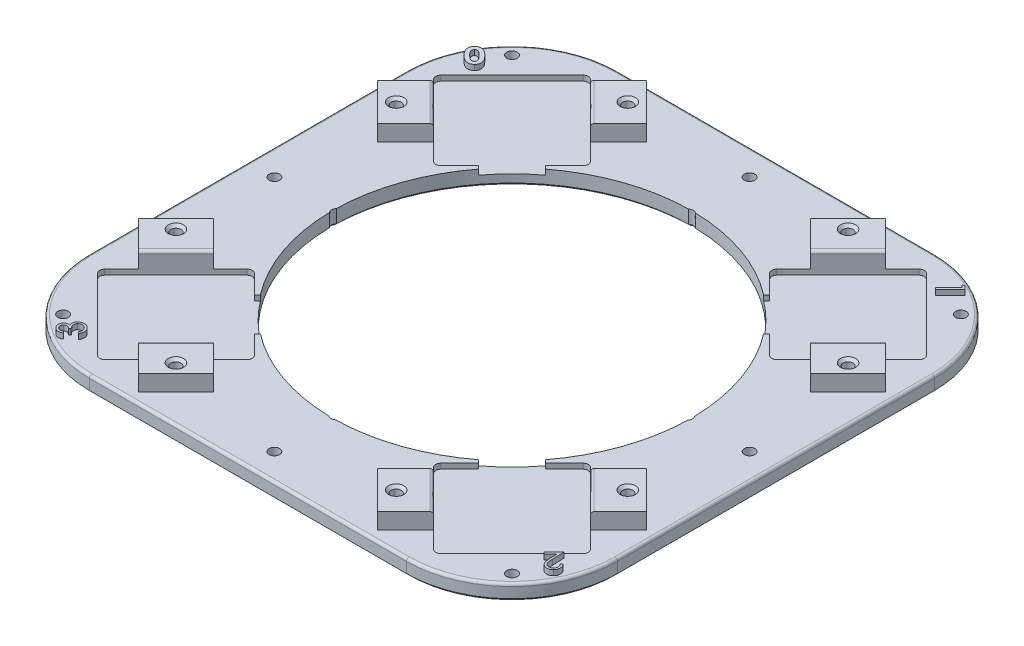
from build123d import *

# Parameters (mm, degrees)
SKETCH_1_W               = 200
SKETCH_1_H               = 200
SKETCH_1_R               = 2
EXTRUDE_1_DEPTH          = 6
CUT_EXTRUDE_1_DEPTH      = 2
FILLET_1_R               = 2
EXTRUDE_3_DEPTH          = 6
FILLET_4_R               = 40
SKETCH_4_R               = 1.9
CUT_EXTRUDE_2_DEPTH      = 8
SKETCH_7_R               = 12
SKETCH_7_W               = 40
SKETCH_7_H               = 12
SKETCH_7_W_2             = 12
SKETCH_7_H_2             = 40
CUT_EXTRUDE_3_DEPTH      = 6
CUT_EXTRUDE_4_DEPTH      = 2
FILLET_6_R               = 1
SKETCH_9_R               = 2
CUT_EXTRUDE_5_DEPTH      = 10
EXTRUDE_6_DEPTH          = 2
FILLET_9_R               = 1
CUT_EXTRUDE_6_DEPTH      = 142.548578234
CUT_EXTRUDE_6_DEPTH_BACK = 142.548578234
SKETCH_11_R              = 68
CHAMFER_1_SIZE           = 1
CHAMFER_2_SIZE           = 1


with BuildPart() as part:
    # Эскиз1 → Бобышка-Вытянуть1 (new body)
    with BuildSketch(Plane(origin=(0, 0, 0), x_dir=(1, 0, 0), z_dir=(0, 1, 0))):
        Rectangle(SKETCH_1_W, SKETCH_1_H)
        with Locations(Location((-90, 0, 0), (0, 0, 270))):
            Circle(SKETCH_1_R, mode=Mode.SUBTRACT)
        with Locations(Location((0, 90, 0), (0, 0, 270))):
            Circle(SKETCH_1_R, mode=Mode.SUBTRACT)
        with Locations(Location((90, 0, 0), (0, 0, 270))):
            Circle(SKETCH_1_R, mode=Mode.SUBTRACT)
        with Locations(Location((0, -90, 0), (0, 0, 270))):
            Circle(SKETCH_1_R, mode=Mode.SUBTRACT)
        with Locations(Location((-85, 85, 0), (0, 0, 270))):
            Circle(SKETCH_1_R, mode=Mode.SUBTRACT)
        with Locations(Location((85, 85, 0), (0, 0, 270))):
            Circle(SKETCH_1_R, mode=Mode.SUBTRACT)
        with Locations(Location((85, -85, 0), (0, 0, 270))):
            Circle(SKETCH_1_R, mode=Mode.SUBTRACT)
        with Locations(Location((-85, -85, 0), (0, 0, 270))):
            Circle(SKETCH_1_R, mode=Mode.SUBTRACT)
    extrude(amount=EXTRUDE_1_DEPTH)

    # Эскиз2 → Вырез-Вытянуть1 (cut)
    with BuildSketch(Plane(origin=(0, 6, 0), x_dir=(1, 0, 0), z_dir=(0, 1, 0))):
        Polygon((63.639610307, 33.941125497), (33.941125497, 63.639610307), (63.639610307, 93.338095117), (93.338095117, 63.639610307), align=None)
        Polygon((33.941125497, -63.639610307), (63.639610307, -33.941125497), (93.338095117, -63.639610307), (63.639610307, -93.338095117), align=None)
        Polygon((-63.639610307, -33.941125497), (-33.941125497, -63.639610307), (-63.639610307, -93.338095117), (-93.338095117, -63.639610307), align=None)
        Polygon((-33.941125497, 63.639610307), (-63.639610307, 33.941125497), (-93.338095117, 63.639610307), (-63.639610307, 93.338095117), align=None)
    extrude(amount=-CUT_EXTRUDE_1_DEPTH, mode=Mode.SUBTRACT)

    # Скругление1
    fillet_1_edges = [part.edges().sort_by_distance(p)[0] for p in [
        (93.338095117, 5, -63.639610307),
        (63.639610307, 5, -33.941125497),
        (33.941125497, 5, -63.639610307),
        (63.639610307, 5, -93.338095117),
        (-93.338095117, 5, 63.639610307),
        (-63.639610307, 5, 33.941125497),
        (-33.941125497, 5, 63.639610307),
        (-63.639610307, 5, 93.338095117),
        (-63.639610307, 5, -93.338095117),
        (-33.941125497, 5, -63.639610307),
        (-63.639610307, 5, -33.941125497),
        (-93.338095117, 5, -63.639610307),
        (63.639610307, 5, 93.338095117),
        (33.941125497, 5, 63.639610307),
        (63.639610307, 5, 33.941125497),
        (93.338095117, 5, 63.639610307),
    ]]
    fillet(fillet_1_edges, radius=FILLET_1_R)

    # Эскиз3 → Бобышка-Вытянуть3 (add)
    with BuildSketch(Plane(origin=(0, 6, 0), x_dir=(1, 0, 0), z_dir=(0, 1, 0))):
        Polygon((41.71930009, 71.4177849), (55.861435714, 85.559920524), (45.254833996, 96.166522241), (31.112698372, 82.024386618), align=None)
        Polygon((85.559920524, 55.861435714), (96.166522241, 45.254833996), (82.024386618, 31.112698372), (71.4177849, 41.71930009), align=None)
        Polygon((71.4177849, -41.71930009), (85.559920524, -55.861435714), (96.166522241, -45.254833996), (82.024386618, -31.112698372), align=None)
        Polygon((31.112698372, -82.024386618), (45.254833996, -96.166522241), (55.861435714, -85.559920524), (41.71930009, -71.4177849), align=None)
        Polygon((-41.71930009, -71.4177849), (-55.861435714, -85.559920524), (-45.254833996, -96.166522241), (-31.112698372, -82.024386618), align=None)
        Polygon((-85.559920524, -55.861435714), (-96.166522241, -45.254833996), (-82.024386618, -31.112698372), (-71.4177849, -41.71930009), align=None)
        Polygon((-71.4177849, 41.71930009), (-85.559920524, 55.861435714), (-96.166522241, 45.254833996), (-82.024386618, 31.112698372), align=None)
        Polygon((-31.112698372, 82.024386618), (-45.254833996, 96.166522241), (-55.861435714, 85.559920524), (-41.71930009, 71.4177849), align=None)
    extrude(amount=EXTRUDE_3_DEPTH)

    # Скругление4
    fillet_4_edges = [part.edges().sort_by_distance(p)[0] for p in [
        (100, 3, 100),
        (-100, 3, 100),
        (-100, 3, -100),
        (100, 3, -100),
    ]]
    fillet(fillet_4_edges, radius=FILLET_4_R)

    # Эскиз4 → Вырез-Вытянуть2 (cut)
    with BuildSketch(Plane(origin=(0, 12, 0), x_dir=(1, 0, 0), z_dir=(0, 1, 0))):
        with Locations(Location((41.71930009, 85.559920524, 0), (0, 0, 270))):
            Circle(SKETCH_4_R)
        with Locations(Location((85.559920524, 41.71930009, 0), (0, 0, 90))):
            Circle(SKETCH_4_R)
        with Locations(Location((85.559920524, -41.71930009, 0), (0, 0, 270))):
            Circle(SKETCH_4_R)
        with Locations(Location((41.71930009, -85.559920524, 0), (0, 0, 90))):
            Circle(SKETCH_4_R)
        with Locations(Location((-41.71930009, -85.559920524, 0), (0, 0, 270))):
            Circle(SKETCH_4_R)
        with Locations(Location((-85.559920524, -41.71930009, 0), (0, 0, 90))):
            Circle(SKETCH_4_R)
        with Locations(Location((-85.559920524, 41.71930009, 0), (0, 0, 270))):
            Circle(SKETCH_4_R)
        with Locations(Location((-41.71930009, 85.559920524, 0), (0, 0, 90))):
            Circle(SKETCH_4_R)
    extrude(amount=-CUT_EXTRUDE_2_DEPTH, mode=Mode.SUBTRACT)

    # Эскиз7 → Вырез-Вытянуть3 (cut)
    with BuildSketch(Plane(origin=(0, 6, 0), x_dir=(1, 0, 0), z_dir=(0, 1, 0))):
        with Locations(Location((28.284271247, 28.284271247, 0), (0, 0, 270))):
            Circle(SKETCH_7_R)
        with Locations(Location((28.284271247, -28.284271247, 0), (0, 0, 270))):
            Circle(SKETCH_7_R)
        with Locations(Location((-28.284271247, -28.284271247, 0), (0, 0, 270))):
            Circle(SKETCH_7_R)
        with Locations(Location((-28.284271247, 28.284271247, 0), (0, 0, 270))):
            Circle(SKETCH_7_R)
        with Locations((40, 0)):
            Rectangle(SKETCH_7_W, SKETCH_7_H)
        with Locations((0, 40)):
            Rectangle(SKETCH_7_W_2, SKETCH_7_H_2)
        with Locations((0, -40)):
            Rectangle(SKETCH_7_W_2, SKETCH_7_H_2)
        with Locations((-40, 0)):
            Rectangle(SKETCH_7_W, SKETCH_7_H)
    extrude(amount=-CUT_EXTRUDE_3_DEPTH, mode=Mode.SUBTRACT)

    # Эскиз8 → Вырез-Вытянуть4 (cut)
    with BuildSketch(Plane(origin=(0, 6, 0), x_dir=(1, 0, 0), z_dir=(0, 1, 0))):
        Polygon((44.547727215, 31.819805153), (31.819805153, 44.547727215), (53.033008589, 65.76093065), (65.76093065, 53.033008589), align=None)
        Polygon((65.76093065, -53.033008589), (53.033008589, -65.76093065), (31.819805153, -44.547727215), (44.547727215, -31.819805153), align=None)
        Polygon((-44.547727215, -31.819805153), (-31.819805153, -44.547727215), (-53.033008589, -65.76093065), (-65.76093065, -53.033008589), align=None)
        Polygon((-65.76093065, 53.033008589), (-53.033008589, 65.76093065), (-31.819805153, 44.547727215), (-44.547727215, 31.819805153), align=None)
    extrude(amount=-CUT_EXTRUDE_4_DEPTH, mode=Mode.SUBTRACT)

    # Скругление6
    fillet_6_edges = [part.edges().sort_by_distance(p)[0] for p in [
        (48.790367902, 12, -78.488852712),
        (78.488852712, 12, -48.790367902),
        (78.488852712, 12, 48.790367902),
        (48.790367902, 12, 78.488852712),
        (-48.790367902, 12, 78.488852712),
        (-78.488852712, 12, 48.790367902),
        (-78.488852712, 12, -48.790367902),
        (-48.790367902, 12, -78.488852712),
    ]]
    fillet(fillet_6_edges, radius=FILLET_6_R)

    # Эскиз9 → Вырез-Вытянуть5 (cut)
    with BuildSketch(Plane(origin=(0, 6, 0), x_dir=(1, 0, 0), z_dir=(0, 1, 0))):
        with Locations(Location((0.141931936, 66.467885895, 0), (0, 0, 270))):
            Circle(SKETCH_9_R)
        with Locations(Location((-0.141931936, -66.467885895, 0), (0, 0, 90))):
            Circle(SKETCH_9_R)
        with Locations(Location((66.467885895, -0.141931936, 0), (0, 0, 270))):
            Circle(SKETCH_9_R)
        with Locations(Location((-66.467885895, 0.141931936, 0), (0, 0, 90))):
            Circle(SKETCH_9_R)
    extrude(amount=-CUT_EXTRUDE_5_DEPTH, mode=Mode.SUBTRACT)

    # Эскиз10 → Бобышка-Вытянуть6 (add)
    # profile 1 of 4: a face of its own
    with BuildSketch(Plane(origin=(0, 6, 0), x_dir=(1, 0, 0), z_dir=(0, 1, 0))):
        with BuildLine():
            add(Edge.make_bspline(
                [(-93.008725725, 78.748142248), (-92.957598681, 78.797521313), (-92.85676014, 78.894912293), (-92.695816741, 79.025623668), (-92.532835835, 79.143607747), (-92.364444707, 79.244705894), (-92.19338747, 79.333809788), (-92.016821516, 79.405990635), (-91.83577231, 79.461704551), (-91.651864556, 79.505826632), (-91.463065577, 79.533008597), (-91.270612251, 79.544105355), (-91.074440499, 79.539176393), (-90.875174478, 79.51794816), (-90.671949254, 79.481192006), (-90.46586329, 79.425437226), (-90.254902601, 79.357171516), (-90.040488058, 79.269212477), (-89.819864955, 79.163420892), (-89.593527751, 79.033863441), (-89.359570967, 78.882570897), (-89.117138773, 78.709656313), (-88.869800196, 78.51114685), (-88.612296924, 78.293135309), (-88.348308293, 78.050855484), (-88.172747767, 77.8784765), (-88.082443673, 77.789808915)],
                knots=[0, 0, 0, 0, 0.898182766, 1.771497688, 2.618542862, 3.439672004, 4.25211909, 5.054711465, 5.847125212, 6.644844624, 7.443249755, 8.254994895, 9.079117631, 9.921086753, 10.786032602, 11.686927653, 12.618018076, 13.587382576, 14.61431454, 15.709081657, 16.881705886, 18.135395254, 19.471648796, 20.88972771, 22.400151059, 24, 24, 24, 24], degree=3))
            add(Edge.make_bspline(
                [(-88.082443673, 77.789808915), (-87.99267599, 77.698463012), (-87.818629055, 77.521356129), (-87.574075163, 77.254376099), (-87.352755723, 76.995556331), (-87.155322982, 76.743444497), (-86.979453593, 76.499753648), (-86.827635494, 76.263265193), (-86.697172812, 76.035199404), (-86.593983854, 75.812528771), (-86.505762897, 75.597863606), (-86.435650692, 75.388405368), (-86.380204903, 75.184114783), (-86.341999183, 74.984749296), (-86.317124562, 74.790489333), (-86.308824987, 74.600690128), (-86.317259045, 74.415819605), (-86.339029871, 74.235495262), (-86.378224262, 74.059121756), (-86.433011633, 73.88543721), (-86.503667028, 73.713843244), (-86.590455303, 73.544917992), (-86.694786221, 73.379663841), (-86.810937292, 73.213769659), (-86.94605157, 73.051911723), (-87.045954632, 72.949414733), (-87.09686675, 72.89718071)],
                knots=[0, 0, 0, 0, 1.626693129, 3.153929617, 4.597923221, 5.951226613, 7.220381534, 8.41370076, 9.519612414, 10.554665343, 11.5286677, 12.466351198, 13.358440621, 14.215441504, 15.042756246, 15.844148676, 16.625203713, 17.391079629, 18.148401381, 18.916678168, 19.701702082, 20.502864672, 21.325687275, 22.182312009, 23.073678591, 24, 24, 24, 24], degree=3))
            add(Edge.make_bspline(
                [(-87.09686675, 72.89718071), (-87.149001816, 72.84614528), (-87.251598834, 72.745712247), (-87.415449357, 72.611920711), (-87.581095452, 72.493010238), (-87.748111845, 72.387124201), (-87.920307836, 72.299502255), (-88.094627597, 72.225293141), (-88.272021467, 72.16710318), (-88.452198674, 72.125173685), (-88.635693302, 72.099819479), (-88.822639538, 72.088904452), (-89.013082719, 72.090828854), (-89.207091086, 72.1143069), (-89.40536909, 72.145719544), (-89.606567507, 72.199199877), (-89.811492576, 72.264759097), (-90.022238393, 72.344954071), (-90.237893224, 72.447094582), (-90.460693886, 72.571345842), (-90.692551034, 72.717439447), (-90.930254984, 72.890031869), (-91.177219561, 73.084109407), (-91.432290045, 73.301626079), (-91.696875667, 73.541020342), (-91.871055441, 73.713771109), (-91.960648802, 73.802629428)],
                knots=[0, 0, 0, 0, 0.933090558, 1.836236452, 2.703091185, 3.541342316, 4.363641911, 5.172278286, 5.963363672, 6.749235136, 7.536057157, 8.330354457, 9.143829215, 9.968822976, 10.828425831, 11.710347207, 12.629007139, 13.581006501, 14.593064946, 15.679156618, 16.843448976, 18.097249152, 19.435871615, 20.861513249, 22.385647378, 24, 24, 24, 24], degree=3))
            add(Edge.make_bspline(
                [(-91.960648802, 73.802629428), (-92.083808079, 73.927961036), (-92.321358131, 74.169701086), (-92.642974702, 74.539928393), (-92.927306321, 74.894846854), (-93.16830981, 75.240335887), (-93.371354338, 75.572879883), (-93.528165963, 75.896472645), (-93.650478298, 76.206379417), (-93.697573804, 76.414092671), (-93.720264186, 76.514167889)],
                knots=[0, 0, 0, 0, 1.286987725, 2.482346486, 3.591022616, 4.616940247, 5.566609133, 6.441717498, 7.249227199, 8, 8, 8, 8], degree=3))
            add(Edge.make_bspline(
                [(-93.720264186, 76.514167889), (-93.73621609, 76.619695189), (-93.767435565, 76.826222703), (-93.769463604, 77.134773214), (-93.73708647, 77.432890992), (-93.662918531, 77.719164849), (-93.557667587, 77.996586653), (-93.410830123, 78.260518954), (-93.228823871, 78.514820834), (-93.083287813, 78.669100547), (-93.008725725, 78.748142248)],
                knots=[0, 0, 0, 0, 1.045976366, 2.04708071, 3.017702948, 3.979968869, 4.940634868, 5.921098241, 6.93492198, 8, 8, 8, 8], degree=3))
        make_face()
        with BuildLine():
            add(Edge.make_bspline(
                [(-91.968661622, 77.762565325), (-92.010462791, 77.716369621), (-92.09267178, 77.625518043), (-92.185599358, 77.466056849), (-92.247808891, 77.292789759), (-92.277000053, 77.138763868), (-92.281564988, 77.009210942), (-92.272569584, 76.906266824), (-92.255217222, 76.798367336), (-92.225720447, 76.685914195), (-92.185705795, 76.569081549), (-92.133366823, 76.447952044), (-92.070623007, 76.322116087), (-91.998518706, 76.18904091), (-91.910791112, 76.051145738), (-91.80930652, 75.904601817), (-91.691866402, 75.749325648), (-91.559047432, 75.584504399), (-91.409818285, 75.411433598), (-91.243944165, 75.230965793), (-91.065124091, 75.039589219), (-90.938036359, 74.911792703), (-90.872507776, 74.845898658)],
                knots=[0, 0, 0, 0, 1.075604722, 2.115356592, 3.167844591, 4.248203041, 4.812243559, 5.405508209, 6.032984943, 6.700942317, 7.414044194, 8.167617197, 8.981822607, 9.846245724, 10.784711884, 11.80756956, 12.929501316, 14.151980212, 15.469127066, 16.882155306, 18.392386567, 20, 20, 20, 20], degree=3))
            add(Edge.make_bspline(
                [(-90.872507776, 74.845898658), (-90.7864976, 74.761480543), (-90.621676348, 74.599710156), (-90.376186673, 74.375708535), (-90.142591105, 74.181411662), (-89.920993001, 74.01580443), (-89.712979922, 73.876185004), (-89.516195184, 73.766835437), (-89.332031918, 73.684611929), (-89.159202852, 73.630270157), (-88.995766399, 73.602382197), (-88.842298, 73.587529693), (-88.696426487, 73.594737092), (-88.558484062, 73.616713591), (-88.427977695, 73.656297414), (-88.306707853, 73.716054158), (-88.190628178, 73.788553381), (-88.124171611, 73.852114178), (-88.090456494, 73.884360197)],
                knots=[0, 0, 0, 0, 1.768629636, 3.389223978, 4.875842697, 6.225868878, 7.447880289, 8.54973518, 9.52566295, 10.403516369, 11.200100902, 11.95533547, 12.661618695, 13.336984531, 14.001570975, 14.653788248, 15.317032326, 16, 16, 16, 16], degree=3))
            add(Edge.make_bspline(
                [(-88.090456494, 73.884360197), (-88.060170206, 73.917273087), (-88.000655379, 73.981949384), (-87.928154313, 74.090301918), (-87.872339217, 74.205569408), (-87.835909962, 74.32905055), (-87.814669853, 74.458862384), (-87.812602281, 74.595619521), (-87.824773104, 74.739340345), (-87.846722465, 74.835951399), (-87.858084699, 74.885962761)],
                knots=[0, 0, 0, 0, 0.992959701, 1.951240279, 2.885912978, 3.828695135, 4.802734124, 5.800367936, 6.861345669, 8, 8, 8, 8], degree=3))
            add(Edge.make_bspline(
                [(-87.858084699, 74.885962761), (-87.877060945, 74.949998607), (-87.916921532, 75.084509222), (-88.007273396, 75.286598194), (-88.126064612, 75.49901867), (-88.272102307, 75.722527903), (-88.44647396, 75.957027887), (-88.648604001, 76.202021519), (-88.880645166, 76.45665197), (-89.04719527, 76.627386506), (-89.133725725, 76.716090966)],
                knots=[0, 0, 0, 0, 0.710523542, 1.492491535, 2.35044932, 3.300180637, 4.333113065, 5.460466168, 6.680595133, 8, 8, 8, 8], degree=3))
            add(Edge.make_bspline(
                [(-89.133725725, 76.716090966), (-89.222964963, 76.803682764), (-89.394241612, 76.971797487), (-89.648507303, 77.205255058), (-89.891423716, 77.406883944), (-90.117816027, 77.583359819), (-90.333231584, 77.728162558), (-90.534384646, 77.845045557), (-90.723026558, 77.930887678), (-90.898556487, 77.990917344), (-91.063656834, 78.023876163), (-91.218731192, 78.040982929), (-91.365199368, 78.039958248), (-91.503588791, 78.020388828), (-91.63445609, 77.984561165), (-91.755276867, 77.926461343), (-91.869565032, 77.855138121), (-91.935391485, 77.793645199), (-91.968661622, 77.762565325)],
                knots=[0, 0, 0, 0, 1.794997963, 3.44513516, 4.953227072, 6.325945798, 7.563759521, 8.676594079, 9.661550624, 10.534529874, 11.333105772, 12.073249666, 12.771110835, 13.429383314, 14.075074024, 14.709742177, 15.347875331, 16, 16, 16, 16], degree=3))
        make_face(mode=Mode.SUBTRACT)
    # profile 2 of 4: a face of its own
    with BuildSketch(Plane(origin=(0, 6, 0), x_dir=(1, 0, 0), z_dir=(0, 1, 0))):
        Polygon((78.440095754, 93.074368887), (79.541057292, 91.973407348), (73.941698318, 86.374048374), (73.385608575, 86.930138118), (78.436890626, 91.981420169), (77.557082933, 92.861227861), align=None)
    # profile 3 of 4: a face of its own
    with BuildSketch(Plane(origin=(0, 6, 0), x_dir=(1, 0, 0), z_dir=(0, 1, 0))):
        with BuildLine():
            Line((92.978731613, -74.683298044), (93.515590587, -74.14643907))
            add(Edge.make_bspline(
                [(93.515590587, -74.14643907), (93.57979168, -74.217561095), (93.705938599, -74.357306758), (93.872192198, -74.580565611), (94.0096643, -74.812483922), (94.124946647, -75.049578001), (94.215404454, -75.292959176), (94.277694742, -75.544127868), (94.316788413, -75.801118589), (94.328555137, -76.062538369), (94.318422495, -76.32287574), (94.281216893, -76.576781617), (94.220051936, -76.822145442), (94.134830229, -77.05845039), (94.025582223, -77.28616355), (93.889081572, -77.503018406), (93.730477042, -77.712924928), (93.608225903, -77.841999489), (93.546039305, -77.907657019)],
                knots=[0, 0, 0, 0, 1.097080493, 2.155622548, 3.181877021, 4.180734131, 5.171877943, 6.149826956, 7.139761318, 8.144411119, 9.14266836, 10.119602376, 11.078258423, 12.0343727, 12.992188754, 13.965052194, 14.964864601, 16, 16, 16, 16], degree=3))
            add(Edge.make_bspline(
                [(93.546039305, -77.907657019), (93.482090698, -77.969428879), (93.356687631, -78.090563349), (93.151429875, -78.244882669), (92.942680032, -78.37895674), (92.725313898, -78.484156569), (92.502307063, -78.567304392), (92.272879379, -78.625036467), (92.036408861, -78.657581549), (91.796858495, -78.662803423), (91.558717577, -78.647071576), (91.328114136, -78.610221179), (91.106309941, -78.554059657), (90.894170445, -78.476955727), (90.69100415, -78.378911034), (90.498450265, -78.258608397), (90.312382857, -78.122050971), (90.200365868, -78.014736799), (90.143795716, -77.960541634)],
                knots=[0, 0, 0, 0, 1.122093018, 2.200421744, 3.237554738, 4.251534574, 5.244276876, 6.239309773, 7.233678941, 8.25294369, 9.26061734, 10.244606756, 11.198736813, 12.14649875, 13.09110873, 14.042419092, 15.011394142, 16, 16, 16, 16], degree=3))
            add(Edge.make_bspline(
                [(90.143795716, -77.960541634), (90.06838982, -77.879576092), (89.91877248, -77.718927525), (89.733967572, -77.445845524), (89.584072127, -77.153182093), (89.489411425, -76.889885212), (89.430647816, -76.660895349), (89.391527922, -76.464896649), (89.354319473, -76.246967695), (89.323162154, -76.005743563), (89.29417061, -75.742397125), (89.270319478, -75.45596892), (89.251579707, -75.147093558), (89.241802351, -74.933312205), (89.236744434, -74.822721121)],
                knots=[0, 0, 0, 0, 1.186803905, 2.354808508, 3.527369274, 4.71059022, 5.350674727, 6.065137202, 6.856453041, 7.724624025, 8.676850923, 9.701662735, 10.811048734, 12, 12, 12, 12], degree=3))
            Line((89.236744434, -74.822721121), (89.12616751, -71.926887788))
            Line((89.12616751, -71.926887788), (86.541231613, -74.511823685))
            Line((86.541231613, -74.511823685), (86.00116751, -73.971759583))
            Line((86.00116751, -73.971759583), (89.804052126, -70.168874967))
            Line((89.804052126, -70.168874967), (89.975526485, -74.61919548))
            add(Edge.make_bspline(
                [(89.975526485, -74.61919548), (89.97940604, -74.72712057), (89.986860215, -74.934487794), (90.003890674, -75.233029494), (90.019624168, -75.50625937), (90.043566004, -75.75394261), (90.06564968, -75.976592217), (90.095425878, -76.173535946), (90.124676221, -76.345461481), (90.168824981, -76.538523396), (90.23936523, -76.755529595), (90.356972999, -76.992365375), (90.498540406, -77.21240251), (90.616674642, -77.339291696), (90.675846998, -77.402849326)],
                knots=[0, 0, 0, 0, 1.320717269, 2.537625612, 3.657091802, 4.667335419, 5.580706193, 6.392834347, 7.10280944, 7.712944814, 8.814093938, 9.883466006, 10.93984752, 12, 12, 12, 12], degree=3))
            add(Edge.make_bspline(
                [(90.675846998, -77.402849326), (90.715762518, -77.440491138), (90.794563147, -77.514803044), (90.923578393, -77.611670036), (91.059857654, -77.691744666), (91.203081359, -77.756245876), (91.352325662, -77.808417727), (91.509417042, -77.84322442), (91.673171622, -77.86207557), (91.841072337, -77.867216475), (92.009961942, -77.855516387), (92.175462222, -77.830692716), (92.335424905, -77.788442162), (92.488974446, -77.730963732), (92.63686883, -77.65745526), (92.779385889, -77.569475576), (92.916642426, -77.465111951), (93.000335801, -77.384492124), (93.042834177, -77.343554455)],
                knots=[0, 0, 0, 0, 0.999414226, 1.973028734, 2.933162718, 3.874301026, 4.831864631, 5.809753659, 6.800020608, 7.832465231, 8.866744497, 9.881594604, 10.878159325, 11.876387246, 12.86478581, 13.883411814, 14.925224832, 16, 16, 16, 16], degree=3))
            add(Edge.make_bspline(
                [(93.042834177, -77.343554455), (93.085971983, -77.29897834), (93.170746275, -77.211377487), (93.280021317, -77.067662313), (93.371539202, -76.917986932), (93.447322526, -76.763501475), (93.507260364, -76.604334053), (93.549404033, -76.439373624), (93.572814515, -76.2684341), (93.581008072, -76.093006632), (93.571727119, -75.914621837), (93.542273015, -75.73648388), (93.495192881, -75.558323393), (93.430044659, -75.380806329), (93.34279892, -75.20509369), (93.240953397, -75.028485632), (93.118160612, -74.853500614), (93.025950971, -74.740939253), (92.978731613, -74.683298044)],
                knots=[0, 0, 0, 0, 1.00435318, 1.973751999, 2.917821866, 3.842935876, 4.757667598, 5.668706735, 6.595277109, 7.548310303, 8.510417973, 9.48367281, 10.468252952, 11.4923997, 12.541405892, 13.642871744, 14.792945286, 16, 16, 16, 16], degree=3))
        make_face()
    # profile 4 of 4: a face of its own
    with BuildSketch(Plane(origin=(0, 6, 0), x_dir=(1, 0, 0), z_dir=(0, 1, 0))):
        with BuildLine():
            Line((-77.388715553, -92.454657468), (-76.802177092, -93.02196516))
            add(Edge.make_bspline(
                [(-76.802177092, -93.02196516), (-76.872074017, -93.066285105), (-77.009193948, -93.153229528), (-77.221245979, -93.263222601), (-77.431874401, -93.355769168), (-77.64204283, -93.427893024), (-77.851510765, -93.48173737), (-78.060252855, -93.514710119), (-78.26822027, -93.532269537), (-78.474255518, -93.526358935), (-78.676988968, -93.504358079), (-78.873717005, -93.464118869), (-79.064802464, -93.407793132), (-79.248731568, -93.334076039), (-79.426690369, -93.243281798), (-79.598271698, -93.136210179), (-79.762535153, -93.010024629), (-79.865353835, -92.915908177), (-79.917561707, -92.868119006)],
                knots=[0, 0, 0, 0, 1.169279398, 2.293827799, 3.37245145, 4.41823223, 5.430864929, 6.42509182, 7.401967133, 8.376183799, 9.33334128, 10.280982312, 11.210249107, 12.145386172, 13.077317515, 14.030476502, 14.999942152, 16, 16, 16, 16], degree=3))
            add(Edge.make_bspline(
                [(-79.917561707, -92.868119006), (-79.988920031, -92.793915351), (-80.13012374, -92.647081306), (-80.306994952, -92.399433841), (-80.450747659, -92.133673041), (-80.562173881, -91.854130293), (-80.638288532, -91.566288195), (-80.673674749, -91.278376936), (-80.670891848, -90.993695007), (-80.628901464, -90.716257597), (-80.552855322, -90.450259759), (-80.442808141, -90.204893605), (-80.306804124, -89.977972028), (-80.190611, -89.848268388), (-80.132305297, -89.783183109)],
                knots=[0, 0, 0, 0, 1.079631469, 2.136372602, 3.182766178, 4.244954198, 5.288217467, 6.299582755, 7.281027378, 8.267633372, 9.236679149, 10.175611233, 11.084521819, 12, 12, 12, 12], degree=3))
            add(Edge.make_bspline(
                [(-80.132305297, -89.783183109), (-80.071332651, -89.724753249), (-79.951762443, -89.610169563), (-79.748381213, -89.471190926), (-79.532010491, -89.364348043), (-79.301508127, -89.289802953), (-79.057050132, -89.248329314), (-78.799158916, -89.239790928), (-78.527911531, -89.261925886), (-78.346160961, -89.301335363), (-78.252497604, -89.321644647)],
                knots=[0, 0, 0, 0, 0.994959293, 1.951161675, 2.892524362, 3.833211752, 4.798837926, 5.80788833, 6.870316961, 8, 8, 8, 8], degree=3))
            add(Edge.make_bspline(
                [(-78.252497604, -89.321644647), (-78.2908941, -89.227417901), (-78.366455678, -89.04198635), (-78.433533784, -88.752543136), (-78.468825619, -88.462397129), (-78.460297874, -88.26936548), (-78.456023245, -88.172606186)],
                knots=[0, 0, 0, 0, 1.034463078, 2.035749934, 3.015397462, 4, 4, 4, 4], degree=3))
            add(Edge.make_bspline(
                [(-78.456023245, -88.172606186), (-78.449288881, -88.105111251), (-78.436049064, -87.972415657), (-78.394386167, -87.778644977), (-78.340246105, -87.592612574), (-78.271950602, -87.41388508), (-78.185386109, -87.244752842), (-78.086329088, -87.082127181), (-77.970712952, -86.92772678), (-77.883148966, -86.832672184), (-77.839036066, -86.784785673)],
                knots=[0, 0, 0, 0, 1.04938919, 2.063107758, 3.062796941, 4.047250166, 5.019961658, 6.00006311, 6.992473739, 8, 8, 8, 8], degree=3))
            add(Edge.make_bspline(
                [(-77.839036066, -86.784785673), (-77.757764137, -86.707011683), (-77.595555492, -86.551784486), (-77.314339011, -86.362283402), (-77.00690324, -86.211377214), (-76.678775657, -86.096957633), (-76.337780488, -86.021689696), (-75.992384551, -85.998456457), (-75.648247161, -86.020429174), (-75.30852581, -86.092358394), (-74.975836653, -86.206866008), (-74.658919531, -86.369981879), (-74.355276993, -86.571977286), (-74.173558247, -86.737405252), (-74.081023245, -86.821644647)],
                knots=[0, 0, 0, 0, 0.966121529, 1.928258222, 2.902202989, 3.904812497, 4.910491246, 5.896124049, 6.872277065, 7.867065951, 8.874013802, 9.889062967, 10.92506653, 12, 12, 12, 12], degree=3))
            add(Edge.make_bspline(
                [(-74.081023245, -86.821644647), (-74.021853204, -86.881667927), (-73.905378738, -86.999821968), (-73.750010399, -87.188779842), (-73.616060265, -87.384318945), (-73.501384782, -87.584883398), (-73.407951202, -87.792558543), (-73.335758423, -88.006211938), (-73.283928402, -88.225649401), (-73.254012973, -88.449994375), (-73.243405037, -88.678597891), (-73.258616666, -88.909429614), (-73.295934925, -89.142204022), (-73.356030565, -89.376896446), (-73.437638527, -89.614740521), (-73.544783279, -89.853551775), (-73.672760277, -90.094886692), (-73.773237898, -90.251289766), (-73.824612989, -90.331260032)],
                knots=[0, 0, 0, 0, 1.045386523, 2.057812277, 3.030335339, 3.9831449, 4.920592867, 5.851197628, 6.777212156, 7.713628621, 8.655634425, 9.611918591, 10.578438017, 11.576706329, 12.614247281, 13.694355822, 14.821103873, 16, 16, 16, 16], degree=3))
            Line((-73.824612989, -90.331260032), (-74.387112989, -89.786388237))
            add(Edge.make_bspline(
                [(-74.387112989, -89.786388237), (-74.356108499, -89.729521047), (-74.295703021, -89.618727748), (-74.216755615, -89.452142222), (-74.152845056, -89.290175233), (-74.101233485, -89.134547193), (-74.061745375, -88.985413058), (-74.03787435, -88.841628771), (-74.0254386, -88.703252914), (-74.028325632, -88.612793387), (-74.029741194, -88.568439519)],
                knots=[0, 0, 0, 0, 1.208474665, 2.354448952, 3.437297787, 4.455450756, 5.412846772, 6.31251137, 7.172595194, 8, 8, 8, 8], degree=3))
            add(Edge.make_bspline(
                [(-74.029741194, -88.568439519), (-74.034859604, -88.513754216), (-74.045091811, -88.404432883), (-74.083607887, -88.244282225), (-74.135192606, -88.087829609), (-74.200435306, -87.934539232), (-74.284661095, -87.786835222), (-74.385183264, -87.644176856), (-74.498874455, -87.503469008), (-74.585051384, -87.416022074), (-74.629100169, -87.371324134)],
                knots=[0, 0, 0, 0, 0.961215761, 1.921565418, 2.877526972, 3.845915068, 4.834977089, 5.850130758, 6.901108131, 8, 8, 8, 8], degree=3))
            add(Edge.make_bspline(
                [(-74.629100169, -87.371324134), (-74.681090431, -87.322723333), (-74.782445027, -87.227976466), (-74.946347893, -87.106489871), (-75.110690459, -87.000747278), (-75.281027643, -86.917143209), (-75.454113249, -86.850977835), (-75.631241254, -86.803553156), (-75.812608999, -86.778698861), (-75.995053098, -86.770559067), (-76.175866677, -86.78030301), (-76.350156794, -86.805831688), (-76.517207594, -86.845992364), (-76.675973132, -86.901663669), (-76.826644699, -86.974919386), (-76.969041379, -87.0634642), (-77.105388267, -87.165921189), (-77.187099009, -87.245903166), (-77.228459143, -87.286388237)],
                knots=[0, 0, 0, 0, 1.175407728, 2.291447812, 3.366826222, 4.401376563, 5.421356114, 6.425777831, 7.424712672, 8.441055237, 9.440185163, 10.412905177, 11.348740396, 12.27587154, 13.188083527, 14.111845111, 15.044258618, 16, 16, 16, 16], degree=3))
            add(Edge.make_bspline(
                [(-77.228459143, -87.286388237), (-77.279535789, -87.343676672), (-77.381130905, -87.457627482), (-77.499712365, -87.655724529), (-77.592090729, -87.869391226), (-77.651660421, -88.098638567), (-77.68282183, -88.334507466), (-77.679719441, -88.572073434), (-77.641973735, -88.806620658), (-77.583578611, -88.999765985), (-77.514478245, -89.154475969), (-77.450854739, -89.280094261), (-77.369835179, -89.411062603), (-77.274409568, -89.548591317), (-77.16717371, -89.695487967), (-77.043439646, -89.847826927), (-76.907482639, -90.009367385), (-76.808529826, -90.115870536), (-76.757305297, -90.171003621)],
                knots=[0, 0, 0, 0, 1.121186236, 2.230119901, 3.361455773, 4.518304567, 5.684940395, 6.834367639, 7.982224936, 9.152000404, 9.775180233, 10.460538472, 11.21144107, 12.026855747, 12.910381899, 13.872566936, 14.898699748, 16, 16, 16, 16], degree=3))
            Line((-76.757305297, -90.171003621), (-77.268523245, -90.698247211))
            add(Edge.make_bspline(
                [(-77.268523245, -90.698247211), (-77.334741975, -90.637662351), (-77.464455594, -90.518984727), (-77.674721718, -90.365511058), (-77.893339725, -90.238268001), (-78.117019946, -90.138197165), (-78.337856669, -90.066171049), (-78.549142261, -90.022294312), (-78.748678618, -90.01180744), (-78.935354408, -90.032599171), (-79.107876819, -90.081434292), (-79.26675635, -90.152405628), (-79.412233777, -90.246112213), (-79.495636262, -90.325050512), (-79.537754015, -90.364913878)],
                knots=[0, 0, 0, 0, 1.265456482, 2.478859708, 3.664135126, 4.827966215, 5.929008543, 6.935492065, 7.863532652, 8.735702181, 9.573157525, 10.382716827, 11.183281726, 12, 12, 12, 12], degree=3))
            add(Edge.make_bspline(
                [(-79.537754015, -90.364913878), (-79.566835094, -90.396326023), (-79.624336337, -90.458436421), (-79.696526522, -90.562084864), (-79.756029374, -90.671258332), (-79.803081897, -90.78690076), (-79.837938732, -90.907750185), (-79.860995191, -91.034995575), (-79.869606859, -91.167658934), (-79.868291906, -91.304874511), (-79.854677693, -91.443051203), (-79.824958806, -91.578642797), (-79.783618958, -91.710304709), (-79.728268952, -91.83776375), (-79.660897843, -91.962176959), (-79.578201221, -92.082039768), (-79.484225877, -92.199700167), (-79.412386344, -92.272065664), (-79.37589504, -92.308824134)],
                knots=[0, 0, 0, 0, 0.945622928, 1.869755011, 2.784173497, 3.690084153, 4.624650255, 5.560708084, 6.543661072, 7.559560387, 8.592687063, 9.607418322, 10.623523625, 11.63942294, 12.675449106, 13.746764168, 14.855455909, 16, 16, 16, 16], degree=3))
            add(Edge.make_bspline(
                [(-79.37589504, -92.308824134), (-79.31341616, -92.364332751), (-79.191190113, -92.472923025), (-78.983632536, -92.597570118), (-78.763503707, -92.682251946), (-78.570315062, -92.721099458), (-78.409608163, -92.72848978), (-78.281445256, -92.725873293), (-78.147312061, -92.709585749), (-78.00752194, -92.679373618), (-77.861262426, -92.641186153), (-77.708597774, -92.591302884), (-77.550032642, -92.528408132), (-77.443524486, -92.47971492), (-77.388715553, -92.454657468)],
                knots=[0, 0, 0, 0, 1.401169659, 2.741077084, 4.038764372, 5.345842331, 6.028511183, 6.737373733, 7.496180119, 8.293104039, 9.137291959, 10.033670791, 10.988130031, 12, 12, 12, 12], degree=3))
        make_face()
    extrude(amount=EXTRUDE_6_DEPTH)

    # Скругление9
    fillet_9_edges = [part.edges().sort_by_distance(p)[0] for p in [
        (0, 6, -100),
        (100, 6, 0),
        (-100, 6, 0),
        (0, 6, 100),
        (-88.284271247, 6, -88.284271247),
        (-88.284271247, 6, 88.284271247),
        (88.284271247, 6, 88.284271247),
        (88.284271247, 6, -88.284271247),
    ]]
    fillet(fillet_9_edges, radius=FILLET_9_R)

    # Эскиз11 → Вырез-Вытянуть6 (cut, two sides: drawn at the far end of the back side and taken through both)
    with BuildSketch(Plane(origin=(0, 6, 0), x_dir=(1, 0, 0), z_dir=(0, 1, 0)).offset(-CUT_EXTRUDE_6_DEPTH_BACK)):
        Circle(SKETCH_11_R)
    extrude(amount=CUT_EXTRUDE_6_DEPTH + CUT_EXTRUDE_6_DEPTH_BACK, mode=Mode.SUBTRACT)

    # Фаска1
    chamfer_1_edges = [part.edges().sort_by_distance(p)[0] for p in [
        (0, 0, -92),
        (90, 0, -2),
        (0, 0, 88),
        (-90, 0, -2),
        (-85, 0, -87),
        (0, 0, -100),
        (100, 0, 0),
        (0, 0, 100),
        (-100, 0, 0),
        (-88.284271247, 0, -88.284271247),
        (-88.284271247, 0, 88.284271247),
        (88.284271247, 0, 88.284271247),
        (88.284271247, 0, -88.284271247),
        (85, 0, -87),
        (85, 0, 83),
        (-85, 0, 83),
        (-0.146202619, 0, 68.467881335),
        (68.467881335, 0, 0.146202619),
        (-68.467881335, 0, -0.146202619),
        (0.146202619, 0, -68.467881335),
        (-48.185825665, 0, 47.980477332),
        (47.980477332, 0, 48.185825665),
        (48.185825665, 0, -47.980477332),
        (-47.980477332, 0, -48.185825665),
    ]]
    chamfer(chamfer_1_edges, length=CHAMFER_1_SIZE)

    # Фаска2
    chamfer_2_edges = [part.edges().sort_by_distance(p)[0] for p in [
        (85.559920524, 12, -39.81930009),
        (85.559920524, 12, 39.81930009),
        (41.71930009, 12, 87.459920524),
        (-41.71930009, 12, 83.659920524),
        (-85.559920524, 12, 43.61930009),
        (-85.559920524, 12, -43.61930009),
        (-41.71930009, 12, -83.659920524),
        (41.71930009, 12, -87.459920524),
    ]]
    chamfer(chamfer_2_edges, length=CHAMFER_2_SIZE)


solid = part.part
